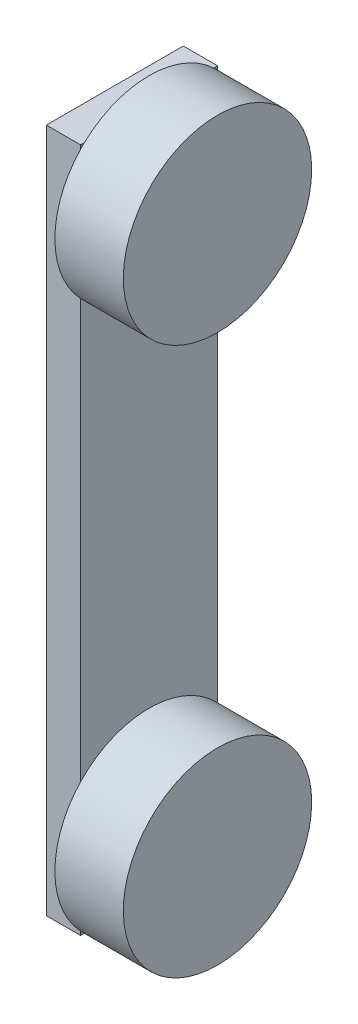
from build123d import *

# Parameters (mm, degrees)
SKETCH1_W           = 50.8
SKETCH1_H           = 254
BOSS_EXTRUDE1_DEPTH = 6.35
SKETCH2_R           = 34.925
BOSS_EXTRUDE2_DEPTH = 25.4


with BuildPart() as part:
    # Sketch1 → Boss-Extrude1 (new, symmetric)
    with BuildSketch(Plane(origin=(0, 0, 0), x_dir=(0, 0, -1), z_dir=(1, 0, 0))):
        Rectangle(SKETCH1_W, SKETCH1_H)
    extrude(amount=BOSS_EXTRUDE1_DEPTH, both=True)

    # Sketch2 → Boss-Extrude2 (add)
    with BuildSketch(Plane(origin=(6.35, 0, 0), x_dir=(0, 0, -1), z_dir=(1, 0, 0))):
        with Locations(Location((0, 101.6, 0), (0, 0, 223.341758227))):
            Circle(SKETCH2_R)
        with Locations(Location((0, -101.6, 0), (0, 0, 136.658241773))):
            Circle(SKETCH2_R)
    extrude(amount=BOSS_EXTRUDE2_DEPTH)


solid = part.part
